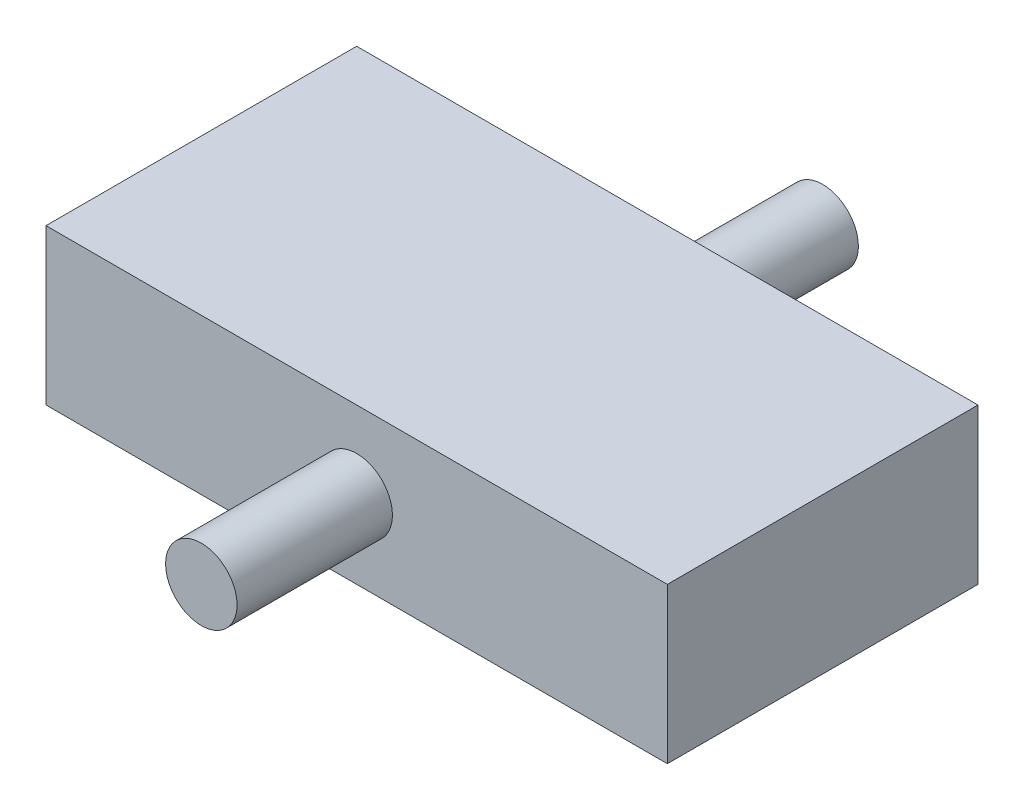
from build123d import *

# Parameters (mm, degrees)
SKETCH1_W           = 101.6
SKETCH1_H           = 50.8
BOSS_EXTRUDE1_DEPTH = 25.4
SKETCH2_R           = 5.842
BOSS_EXTRUDE2_DEPTH = 25.4


with BuildPart() as part:
    # Sketch1 → Boss-Extrude1 (new body)
    with BuildSketch(Plane(origin=(0, 0, 0), x_dir=(1, 0, 0), z_dir=(0, 1, 0))):
        Rectangle(SKETCH1_W, SKETCH1_H)
    extrude(amount=BOSS_EXTRUDE1_DEPTH)

    # Sketch2 → Boss-Extrude2 (add)
    with BuildSketch(Plane.XY.offset(25.4)):
        with Locations(Location((0, 12.7, 0), (0, 0, 180))):
            Circle(SKETCH2_R)
    boss_extrude2 = extrude(amount=BOSS_EXTRUDE2_DEPTH)

    # Mirror1: Boss-Extrude2 across plane
    add(boss_extrude2.mirror(Plane.XY))


solid = part.part
